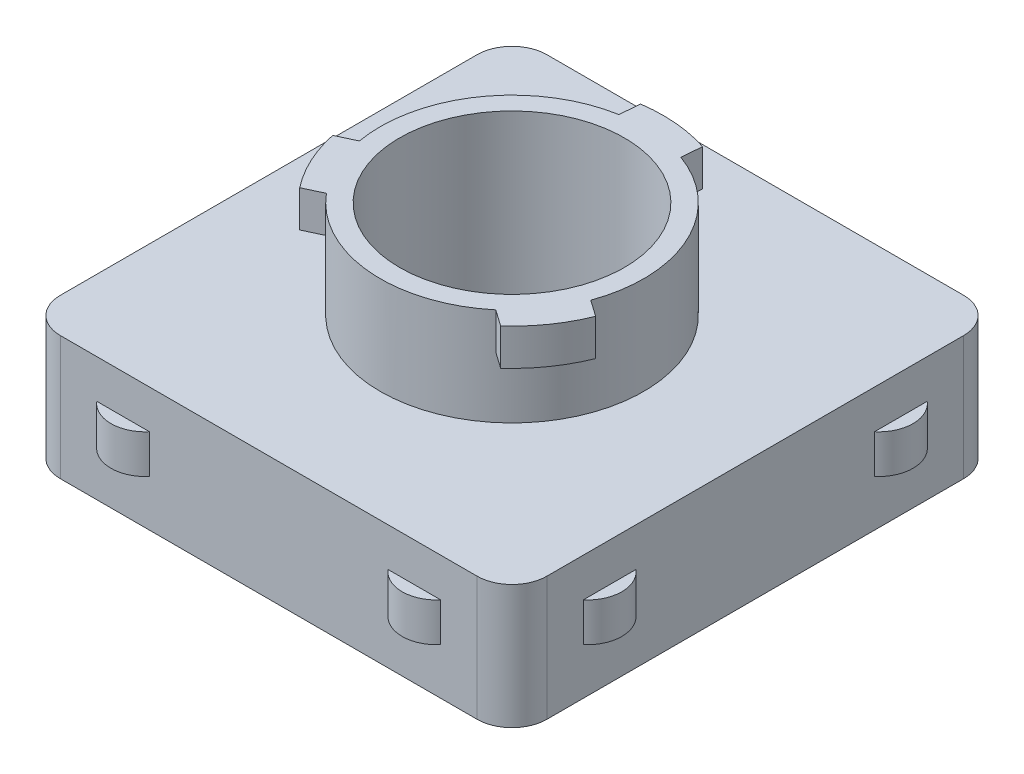
from build123d import *

# Parameters (mm, degrees)
SKETCH1_W           = 39.8655
SKETCH1_H           = 39.8655
BOSS_EXTRUDE1_DEPTH = 10.16
SKETCH2_R           = 10.795
SKETCH2_R_2         = 9.2075
BOSS_EXTRUDE2_DEPTH = 8
BOSS_EXTRUDE3_START = -3
BOSS_EXTRUDE3_DEPTH = 3
CIRPATTERN1_COUNT   = 3
BOSS_EXTRUDE4_DEPTH = 6.35
CUT_EXTRUDE1_DEPTH  = 3.175
FILLET1_R           = 2.8575
SKETCH13_R          = 9.2075
CUT_EXTRUDE2_DEPTH  = 31.638540192
CIRPATTERN2_COUNT   = 4


with BuildPart() as part:
    # Sketch1 → Boss-Extrude1 (new body)
    with BuildSketch(Plane(origin=(0, 0, 0), x_dir=(1, 0, 0), z_dir=(0, 1, 0))):
        Rectangle(SKETCH1_W, SKETCH1_H)
    extrude(amount=BOSS_EXTRUDE1_DEPTH)

    # Sketch2 → Boss-Extrude2 (add)
    with BuildSketch(Plane(origin=(0, 10.16, 0), x_dir=(1, 0, 0), z_dir=(0, 1, 0))):
        Circle(SKETCH2_R)
        Circle(SKETCH2_R_2, mode=Mode.SUBTRACT)
    extrude(amount=BOSS_EXTRUDE2_DEPTH)

    # Sketch5 → Boss-Extrude3 (add)
    with BuildSketch(Plane(origin=(0, 18.16, 0), x_dir=(1, 0, 0), z_dir=(0, 1, 0)).offset(BOSS_EXTRUDE3_START)):
        with BuildLine():
            ThreePointArc((10.143998982, -3.692060354), (8.842746318, -6.19175763), (6.938853856, -8.269481977))
            Line((6.938853856, -8.269481977), (8.286221198, -9.212918747))
            ThreePointArc((8.286221198, -9.212918747), (10.150194049, -7.107242387), (11.491366324, -4.635497124))
            Line((11.491366324, -4.635497124), (10.143998982, -3.692060354))
        make_face()
    boss_extrude3 = extrude(amount=BOSS_EXTRUDE3_DEPTH)

    # CirPattern1: Boss-Extrude3 ×3 about axis
    cirpattern1_axis = Axis((0, 18.16, 0), (0, 1, 0))
    for i in range(1, CIRPATTERN1_COUNT):
        add(boss_extrude3.rotate(cirpattern1_axis, i * 360 / CIRPATTERN1_COUNT))

    # Sketch6 → Boss-Extrude4 (add)
    with BuildSketch(Plane(origin=(0, 10.16, 0), x_dir=(1, 0, 0), z_dir=(0, 1, 0))):
        with BuildLine():
            Line((-14.09175, 19.93275), (-9.77375, 19.93275))
            ThreePointArc((-9.77375, 19.93275), (-11.93275, 20.93275), (-14.09175, 19.93275))
        make_face()
        with BuildLine():
            Line((9.77375, 19.93275), (14.09175, 19.93275))
            ThreePointArc((14.09175, 19.93275), (11.93275, 20.93275), (9.77375, 19.93275))
        make_face()
    boss_extrude4 = extrude(amount=-BOSS_EXTRUDE4_DEPTH)

    # Sketch7 → Cut-Extrude1 (cut)
    with BuildSketch(Plane(origin=(0, 10.16, 0), x_dir=(1, 0, 0), z_dir=(0, 1, 0))):
        with BuildLine():
            Line((-14.09175, 19.93275), (-9.77375, 19.93275))
            ThreePointArc((-9.77375, 19.93275), (-11.93275, 20.93275), (-14.09175, 19.93275))
        make_face()
        with BuildLine():
            ThreePointArc((14.09175, 19.93275), (11.93275, 20.93275), (9.77375, 19.93275))
            Line((9.77375, 19.93275), (14.09175, 19.93275))
        make_face()
    cut_extrude1 = extrude(amount=-CUT_EXTRUDE1_DEPTH, mode=Mode.SUBTRACT)

    # Fillet1
    fillet1_edges = [part.edges().sort_by_distance(p)[0] for p in [
        (-19.93275, 5.08, 19.93275),
        (-19.93275, 5.08, -19.93275),
        (19.93275, 5.08, -19.93275),
        (19.93275, 5.08, 19.93275),
    ]]
    fillet(fillet1_edges, radius=FILLET1_R)

    # Sketch13 → Cut-Extrude2 (cut, through all)
    with BuildSketch(Plane(origin=(0, 10.16, 0), x_dir=(1, 0, 0), z_dir=(0, 1, 0))):
        Circle(SKETCH13_R)
    extrude(amount=-CUT_EXTRUDE2_DEPTH, mode=Mode.SUBTRACT)

    # CirPattern2: Boss-Extrude4, Cut-Extrude1 ×4 about axis
    cirpattern2_axis = Axis((0, 18.16, 0), (0, 1, 0))
    add([boss_extrude4.rotate(cirpattern2_axis, i * 360 / CIRPATTERN2_COUNT) for i in range(1, CIRPATTERN2_COUNT)])
    add([cut_extrude1.rotate(cirpattern2_axis, i * 360 / CIRPATTERN2_COUNT) for i in range(1, CIRPATTERN2_COUNT)], mode=Mode.SUBTRACT)


solid = part.part
